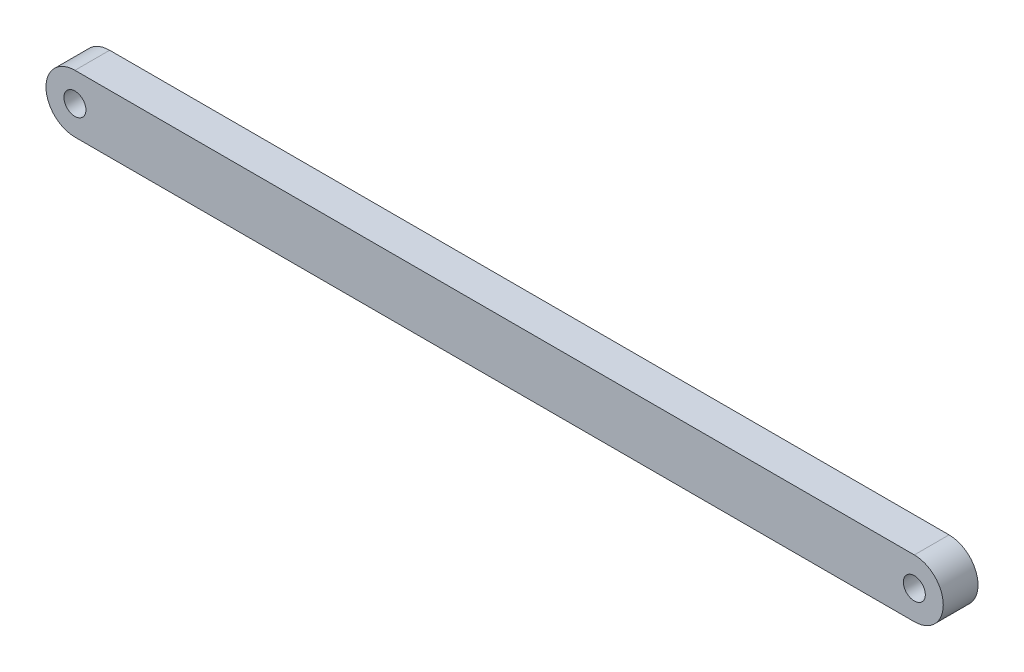
from build123d import *

# Parameters (mm, degrees)
SKETCH1_R           = 1.9
BOSS_EXTRUDE1_DEPTH = 6


with BuildPart() as part:
    # Sketch1 → Boss-Extrude1 (new body)
    with BuildSketch(Plane.XY):
        with BuildLine():
            Line((-72.5, 5), (72.5, 5))
            ThreePointArc((72.5, 5), (77.5, 0), (72.5, -5))
            Line((72.5, -5), (-72.5, -5))
            ThreePointArc((-72.5, -5), (-77.5, 0), (-72.5, 5))
        make_face()
        with Locations((-72.5, 0)):
            Circle(SKETCH1_R, mode=Mode.SUBTRACT)
        with Locations((72.5, 0)):
            Circle(SKETCH1_R, mode=Mode.SUBTRACT)
    extrude(amount=BOSS_EXTRUDE1_DEPTH)


solid = part.part
